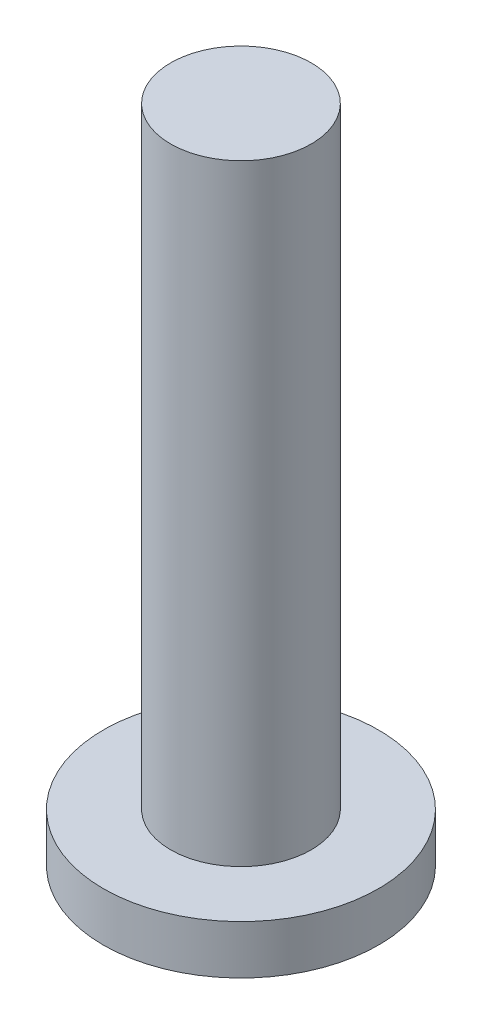
from build123d import *

# Parameters (mm, degrees)
SKETCH1_R           = 2.8575
SKETCH1_R_2         = 1.4605
BOSS_EXTRUDE2_DEPTH = 1.016
SKETCH1_5_R         = 1.4605
BOSS_EXTRUDE3_DEPTH = 13.716


with BuildPart() as part:
    # Sketch1 → Boss-Extrude2 (new body)
    with BuildSketch(Plane(origin=(0, 0, 0), x_dir=(1, 0, 0), z_dir=(0, 1, 0))):
        Circle(SKETCH1_R)
        Circle(SKETCH1_R_2, mode=Mode.SUBTRACT)
    extrude(amount=BOSS_EXTRUDE2_DEPTH)

    # Sketch1<5> → Boss-Extrude3 (add)
    with BuildSketch(Plane(origin=(0, 0, 0), x_dir=(1, 0, 0), z_dir=(0, 1, 0))):
        Circle(SKETCH1_5_R)
    extrude(amount=BOSS_EXTRUDE3_DEPTH)


solid = part.part
